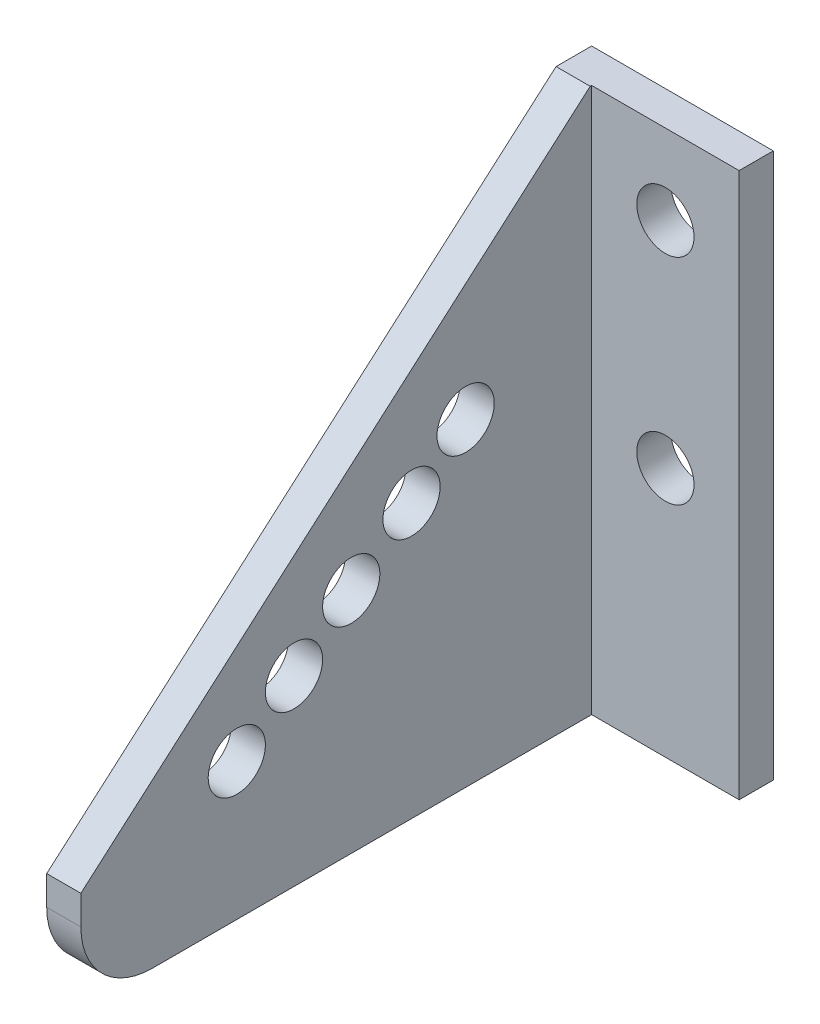
from build123d import *

# Parameters (mm, degrees)
BOSS_EXTRUDE1_DEPTH = 76.2
SKETCH2_R           = 4
CUT_EXTRUDE1_DEPTH  = 76.2
SKETCH3_R           = 4
CUT_EXTRUDE2_DEPTH  = 76.2


with BuildPart() as part:
    # Sketch1 → Boss-Extrude1 (new body)
    with BuildSketch(Plane(origin=(0, 0, 0), x_dir=(1, 0, 0), z_dir=(0, 1, 0))):
        Polygon((0, -76.2), (0, 0), (25.4, 0), (25.4, -4.7752), (4.7752, -4.7752), (4.7752, -76.2), align=None)
    extrude(amount=BOSS_EXTRUDE1_DEPTH)

    # Sketch2 → Cut-Extrude1 (cut)
    with BuildSketch(Plane.ZY):
        Polygon((76.2, 76.2), (4.977758466, 76.2), (76.2, 14.082460982), align=None)
        with BuildLine():
            Line((76.2, 0), (76.2, 10))
            ThreePointArc((76.2, 10), (73.271067812, 2.928932188), (66.2, 0))
            Line((66.2, 0), (76.2, 0))
        make_face()
        with Locations((22.3960373, 44.563386378)):
            Circle(SKETCH2_R)
        with Locations((29.95676578, 38.213386378)):
            Circle(SKETCH2_R)
        with Locations((38.3960373, 31.863386378)):
            Circle(SKETCH2_R)
        with Locations((46.3960373, 25.513386378)):
            Circle(SKETCH2_R)
        with Locations((54.3960373, 19.163386378)):
            Circle(SKETCH2_R)
    extrude(amount=-CUT_EXTRUDE1_DEPTH, mode=Mode.SUBTRACT)

    # Sketch3 → Cut-Extrude2 (cut)
    with BuildSketch(Plane.XY.offset(4.7752)):
        with Locations((15.0876, 65)):
            Circle(SKETCH3_R)
        with Locations((15.0876, 35)):
            Circle(SKETCH3_R)
    extrude(amount=-CUT_EXTRUDE2_DEPTH, mode=Mode.SUBTRACT)


solid = part.part
